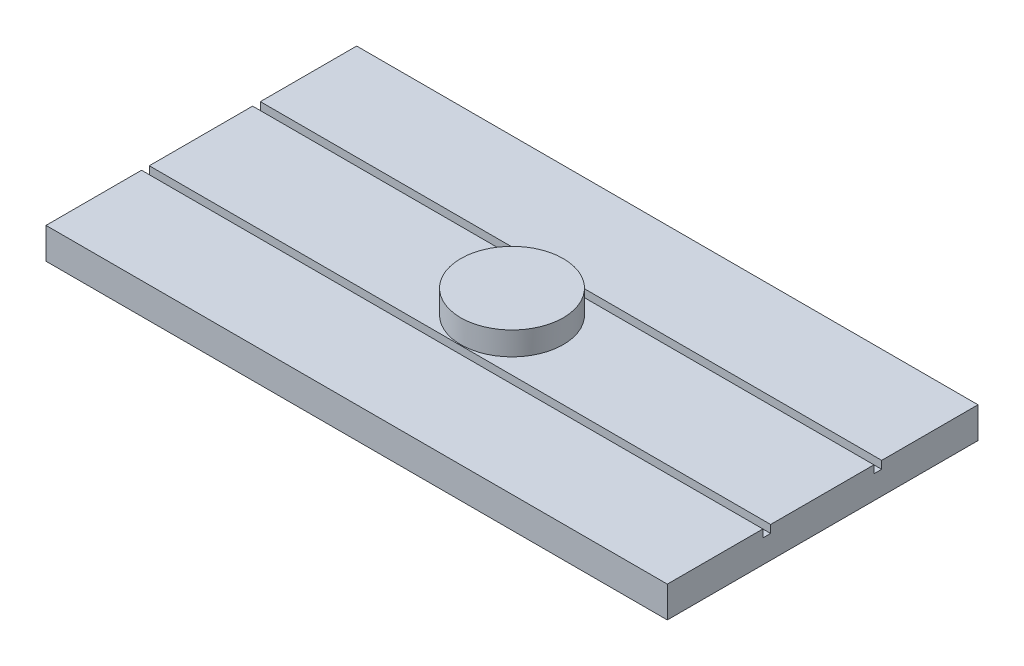
from build123d import *

# Parameters (mm, degrees)
SKETCH1_W           = 101.6
SKETCH1_H           = 50.8
BOSS_EXTRUDE1_DEPTH = 5.08
SKETCH2_R           = 8.382
BOSS_EXTRUDE2_DEPTH = 8.89
SKETCH4_W           = 101.6
SKETCH4_H           = 1.27
CUT_EXTRUDE1_DEPTH  = 1.27
SKETCH5_W           = 101.6
SKETCH5_H           = 1.27
CUT_EXTRUDE2_DEPTH  = 1.27


with BuildPart() as part:
    # Sketch1 → Boss-Extrude1 (new body)
    with BuildSketch(Plane(origin=(0, 0, 0), x_dir=(1, 0, 0), z_dir=(0, 1, 0))):
        with Locations((50.8, 25.4)):
            Rectangle(SKETCH1_W, SKETCH1_H)
    extrude(amount=BOSS_EXTRUDE1_DEPTH)

    # Sketch2 → Boss-Extrude2 (add)
    with BuildSketch(Plane(origin=(0, 0, 0), x_dir=(1, 0, 0), z_dir=(0, 1, 0))):
        with Locations(Location((50.8, 25.4, 0), (0, 0, 90))):
            Circle(SKETCH2_R)
    extrude(amount=BOSS_EXTRUDE2_DEPTH)

    # Sketch4 → Cut-Extrude1 (cut)
    with BuildSketch(Plane(origin=(0, 5.08, 0), x_dir=(1, 0, 0), z_dir=(0, 1, 0))):
        with Locations((50.8, 34.417)):
            Rectangle(SKETCH4_W, SKETCH4_H)
    extrude(amount=-CUT_EXTRUDE1_DEPTH, mode=Mode.SUBTRACT)

    # Sketch5 → Cut-Extrude2 (cut)
    with BuildSketch(Plane(origin=(0, 5.08, 0), x_dir=(1, 0, 0), z_dir=(0, 1, 0))):
        with Locations((50.8, 16.256)):
            Rectangle(SKETCH5_W, SKETCH5_H)
    extrude(amount=-CUT_EXTRUDE2_DEPTH, mode=Mode.SUBTRACT)


solid = part.part
